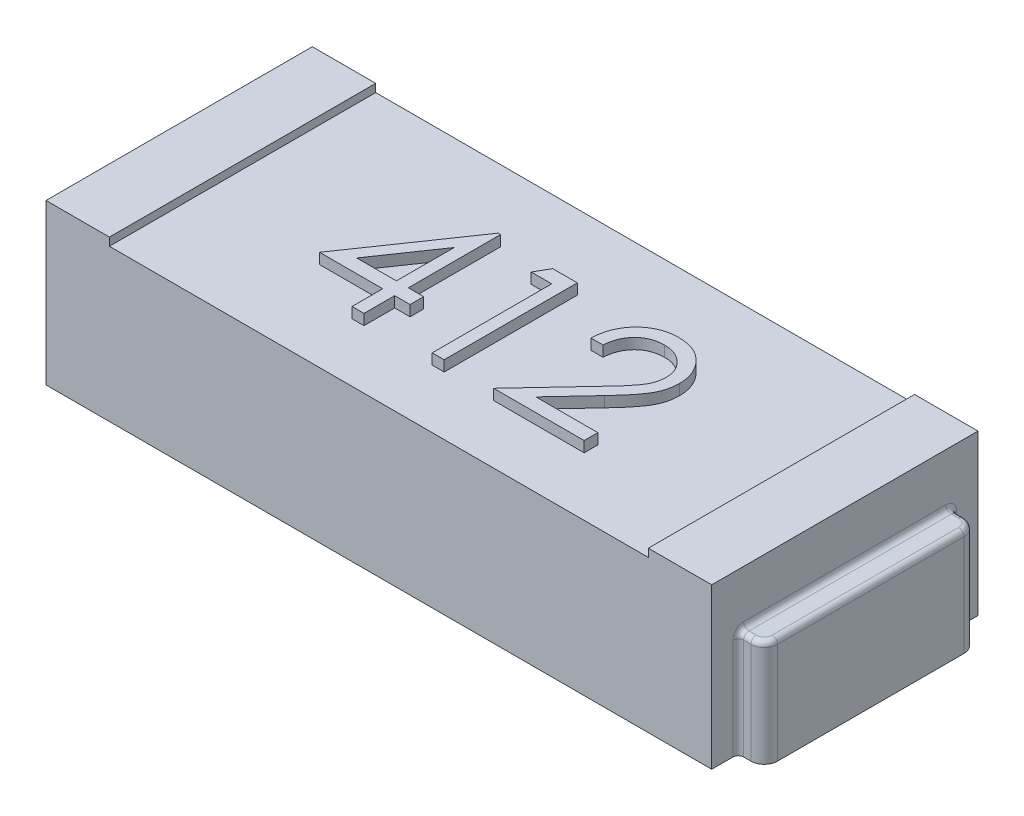
from build123d import *

# Parameters (mm, degrees)
ESQUISSE1_W             = 2.5
ESQUISSE1_H             = 1
BOSS_EXTRU_1_DEPTH      = 0.6
ESQUISSE2_W             = 2.023603034
ESQUISSE2_H             = 1
ENL_V_MAT_EXTRU_1_DEPTH = 0.03
BOSS_EXTRU_2_DEPTH      = 0.4
CONG_1_R                = 0.02
CONG_1_OF_SYM_TRIE2_R   = 0.02
BOSS_EXTRU_3_DEPTH      = 0.04


with BuildPart() as part:
    # Esquisse1 → Boss.-Extru.1 (new body)
    with BuildSketch(Plane(origin=(0, 0, 0), x_dir=(1, 0, 0), z_dir=(0, 1, 0))):
        Rectangle(ESQUISSE1_W, ESQUISSE1_H)
    extrude(amount=BOSS_EXTRU_1_DEPTH)

    # Esquisse2 → Enlèv. mat.-Extru.1 (cut)
    with BuildSketch(Plane(origin=(0, 0.6, 0), x_dir=(1, 0, 0), z_dir=(0, 1, 0))):
        Rectangle(ESQUISSE2_W, ESQUISSE2_H)
    extrude(amount=-ENL_V_MAT_EXTRU_1_DEPTH, mode=Mode.SUBTRACT)

    # Esquisse3 → Boss.-Extru.2 (add)
    with BuildSketch(Plane(origin=(0, 0, 0), x_dir=(1, 0, 0), z_dir=(0, 1, 0))):
        with BuildLine():
            Line((1.25, 0.4), (1.297141448, 0.4))
            ThreePointArc((1.297141448, 0.4), (1.332496787, 0.385355339), (1.347141448, 0.35))
            Line((1.347141448, 0.35), (1.347141448, -0.35))
            ThreePointArc((1.347141448, -0.35), (1.332496787, -0.385355339), (1.297141448, -0.4))
            Line((1.297141448, -0.4), (1.25, -0.4))
            Line((1.25, -0.4), (1.25, 0.4))
        make_face()
    boss_extru_2 = extrude(amount=BOSS_EXTRU_2_DEPTH)

    # Congé1
    cong_1_edges = [part.edges().sort_by_distance(p)[0] for p in [
        (1.25, 0.2, -0.4),
        (1.25, 0.2, 0.4),
        (1.25, 0.4, 0),
        (1.273570724, 0.4, 0.4),
        (1.332496787, 0.4, 0.385355339),
        (1.347141448, 0.4, 0),
        (1.332496787, 0.4, -0.385355339),
        (1.273570724, 0.4, -0.4),
    ]]
    fillet(cong_1_edges, radius=CONG_1_R)

    # Symétrie2: Boss.-Extru.2 across plane
    add(boss_extru_2.mirror(Plane(origin=(0, 0, 0), x_dir=(0, 0, 1), z_dir=(1, 0, 0))))

    # Congé1 of Symétrie2
    cong_1_of_sym_trie2_edges = [part.edges().sort_by_distance(p)[0] for p in [
        (-1.25, 0.2, -0.4),
        (-1.25, 0.2, 0.4),
        (-1.25, 0.4, 0),
        (-1.273570724, 0.4, 0.4),
        (-1.332496787, 0.4, 0.385355339),
        (-1.347141448, 0.4, 0),
        (-1.332496787, 0.4, -0.385355339),
        (-1.273570724, 0.4, -0.4),
    ]]
    fillet(cong_1_of_sym_trie2_edges, radius=CONG_1_OF_SYM_TRIE2_R)

    # Esquisse4 → Boss.-Extru.3 (add)
    # profile 1 of 3: a face of its own
    with BuildSketch(Plane(origin=(0, 0.57, 0), x_dir=(1, 0, 0), z_dir=(0, 1, 0))):
        with BuildLine():
            Line((0.275641026, 0.065854324), (0.230769231, 0.065854324))
            add(Edge.make_bspline(
                [(0.230769231, 0.065854324), (0.231061681, 0.071807307), (0.231636046, 0.08349881), (0.234325802, 0.100545082), (0.238174498, 0.116838625), (0.243616135, 0.132248612), (0.250374174, 0.146911299), (0.258478464, 0.160768444), (0.268077586, 0.173767185), (0.278964262, 0.18578702), (0.290788353, 0.196813816), (0.303546344, 0.206335994), (0.316952777, 0.214381375), (0.330966977, 0.221107267), (0.345747057, 0.226155816), (0.361158894, 0.229901765), (0.377270199, 0.232155528), (0.388247345, 0.232397784), (0.393830128, 0.23252099)],
                knots=[0, 0, 0, 0, 1.10065271, 2.161652631, 3.183658789, 4.190468796, 5.17591951, 6.163126047, 7.15150782, 8.156236427, 9.156009102, 10.134482811, 11.092018607, 12.041330605, 13.001268258, 13.972401359, 14.968799086, 16, 16, 16, 16], degree=3))
            add(Edge.make_bspline(
                [(0.393830128, 0.23252099), (0.39931271, 0.232392639), (0.410085788, 0.232140434), (0.425808933, 0.229974573), (0.440777118, 0.226582346), (0.454961085, 0.221823), (0.468247665, 0.215425225), (0.480736672, 0.207739862), (0.492576787, 0.198851315), (0.503234899, 0.188386485), (0.513021768, 0.177214715), (0.521464947, 0.165287872), (0.528695399, 0.152969403), (0.53472221, 0.140165374), (0.539158802, 0.126755227), (0.542527117, 0.112934198), (0.544431033, 0.098559225), (0.544723237, 0.088829717), (0.544871795, 0.08388317)],
                knots=[0, 0, 0, 0, 1.111607364, 2.184268762, 3.212621178, 4.221274766, 5.211760367, 6.196651075, 7.1921475, 8.207485113, 9.220403448, 10.201281604, 11.166441695, 12.114753415, 13.065576456, 14.026450734, 14.996634279, 16, 16, 16, 16], degree=3))
            add(Edge.make_bspline(
                [(0.544871795, 0.08388317), (0.5446299, 0.076919193), (0.544150356, 0.063113449), (0.540048302, 0.042825611), (0.533641657, 0.023169408), (0.525927749, 0.007349794), (0.518145972, -0.005397848), (0.511133471, -0.015893378), (0.502924212, -0.027194159), (0.493398712, -0.03926235), (0.482754016, -0.052192479), (0.470893707, -0.065976736), (0.45773321, -0.080472703), (0.448496281, -0.090373503), (0.443709936, -0.09550385)],
                knots=[0, 0, 0, 0, 1.184426356, 2.348067706, 3.509069118, 4.696110526, 5.333549288, 6.050745305, 6.844228056, 7.710549037, 8.667450064, 9.695053472, 10.805634456, 12, 12, 12, 12], degree=3))
            Line((0.443709936, -0.09550385), (0.318609776, -0.229017471))
            Line((0.318609776, -0.229017471), (0.551282051, -0.229017471))
            Line((0.551282051, -0.229017471), (0.551282051, -0.280299523))
            Line((0.551282051, -0.280299523), (0.211538462, -0.280299523))
            Line((0.211538462, -0.280299523), (0.405448718, -0.073368433))
            add(Edge.make_bspline(
                [(0.405448718, -0.073368433), (0.410169845, -0.068440103), (0.419238163, -0.058973791), (0.432064245, -0.045153368), (0.443584101, -0.032332005), (0.4538723, -0.020533927), (0.462705658, -0.00958656), (0.470544548, 0.000155541), (0.476825347, 0.009120462), (0.483641832, 0.019511978), (0.490243829, 0.032199452), (0.495917023, 0.047704265), (0.499376287, 0.063665301), (0.499791263, 0.074451306), (0.5, 0.079876759)],
                knots=[0, 0, 0, 0, 1.329631726, 2.553950428, 3.673215718, 4.687767853, 5.603093632, 6.413772471, 7.123043292, 7.734684054, 8.834405432, 9.900288307, 10.943827018, 12, 12, 12, 12], degree=3))
            add(Edge.make_bspline(
                [(0.5, 0.079876759), (0.49990918, 0.083288388), (0.49973019, 0.090012052), (0.498150519, 0.099870018), (0.495763304, 0.109379277), (0.492342553, 0.11856908), (0.487827304, 0.12734703), (0.482331107, 0.135723813), (0.47598967, 0.143822236), (0.468653774, 0.151415565), (0.460594985, 0.158370023), (0.452081521, 0.164530606), (0.443074363, 0.169679051), (0.433611489, 0.17389955), (0.423719279, 0.177210319), (0.413378601, 0.179504402), (0.402618027, 0.180944757), (0.395270385, 0.181139638), (0.391526442, 0.181238939)],
                knots=[0, 0, 0, 0, 0.991446411, 1.95395049, 2.89581595, 3.838931463, 4.798493298, 5.75982156, 6.748411868, 7.785213223, 8.824556874, 9.840280684, 10.836137867, 11.835679398, 12.848801643, 13.863922112, 14.911575587, 16, 16, 16, 16], degree=3))
            add(Edge.make_bspline(
                [(0.391526442, 0.181238939), (0.387616323, 0.181136791), (0.379937495, 0.180936191), (0.368663348, 0.179532953), (0.357908237, 0.177112119), (0.347645108, 0.173801165), (0.337856595, 0.169592801), (0.328590303, 0.164351123), (0.319867034, 0.158096338), (0.311670387, 0.15100483), (0.30411839, 0.143109459), (0.297483122, 0.134308036), (0.291685406, 0.124761262), (0.286626944, 0.114494898), (0.282518988, 0.103415786), (0.279379967, 0.091563257), (0.276896132, 0.078988774), (0.276066343, 0.07030519), (0.275641026, 0.065854324)],
                knots=[0, 0, 0, 0, 1.031018746, 2.02475058, 2.990194455, 3.934040569, 4.864654155, 5.795059489, 6.735614925, 7.690564532, 8.649604399, 9.611025574, 10.590972636, 11.591080095, 12.624614302, 13.701020113, 14.821632451, 16, 16, 16, 16], degree=3))
        make_face()
    # profile 2 of 3: a face of its own
    with BuildSketch(Plane(origin=(0, 0.57, 0), x_dir=(1, 0, 0), z_dir=(0, 1, 0))):
        Polygon((-0.066806891, 0.219700477), (0.025641026, 0.219700477), (0.025641026, -0.280299523), (-0.019230769, -0.280299523), (-0.019230769, 0.168418426), (-0.096153846, 0.168418426), align=None)
    # profile 3 of 3: a face of its own
    with BuildSketch(Plane(origin=(0, 0.57, 0), x_dir=(1, 0, 0), z_dir=(0, 1, 0))):
        Polygon((-0.284755609, 0.23252099), (-0.275641026, 0.23252099), (-0.275641026, -0.113632856), (-0.217948718, -0.113632856), (-0.217948718, -0.164914907), (-0.275641026, -0.164914907), (-0.275641026, -0.280299523), (-0.320512821, -0.280299523), (-0.320512821, -0.164914907), (-0.557692308, -0.164914907), align=None)
        Polygon((-0.320512821, -0.113632856), (-0.320512821, 0.10351458), (-0.469551282, -0.113632856), align=None, mode=Mode.SUBTRACT)
    extrude(amount=BOSS_EXTRU_3_DEPTH)


solid = part.part
